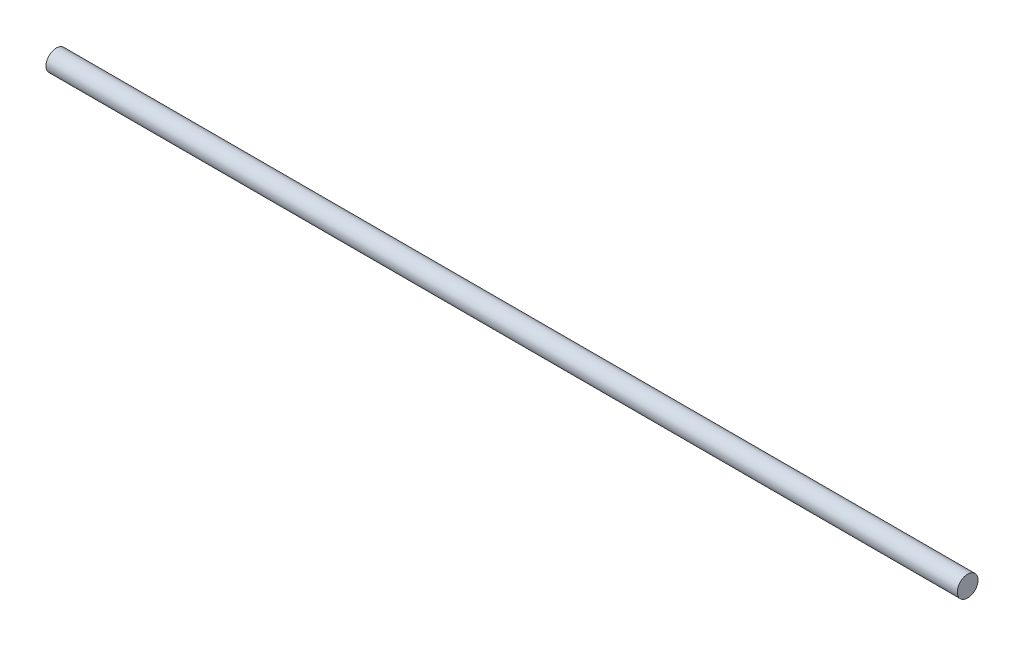
from build123d import *

# Parameters (mm, degrees)
SKETCH1_W = 1117.6
SKETCH1_H = 12.7


with BuildPart() as part:
    # Sketch1 → Revolve1 (revolve)
    with BuildSketch(Plane(origin=(0, 0, 0), x_dir=(1, 0, 0), z_dir=(0, 1, 0)), mode=Mode.PRIVATE) as revolve1_sk:
        with Locations((558.8, 6.35)):
            Rectangle(SKETCH1_W, SKETCH1_H)
    revolve(revolve1_sk.sketch.rotate(Axis((0, 0, 0), (1, 0, 0)), 180), axis=Axis((0, 0, 0), (1, 0, 0)))


solid = part.part
